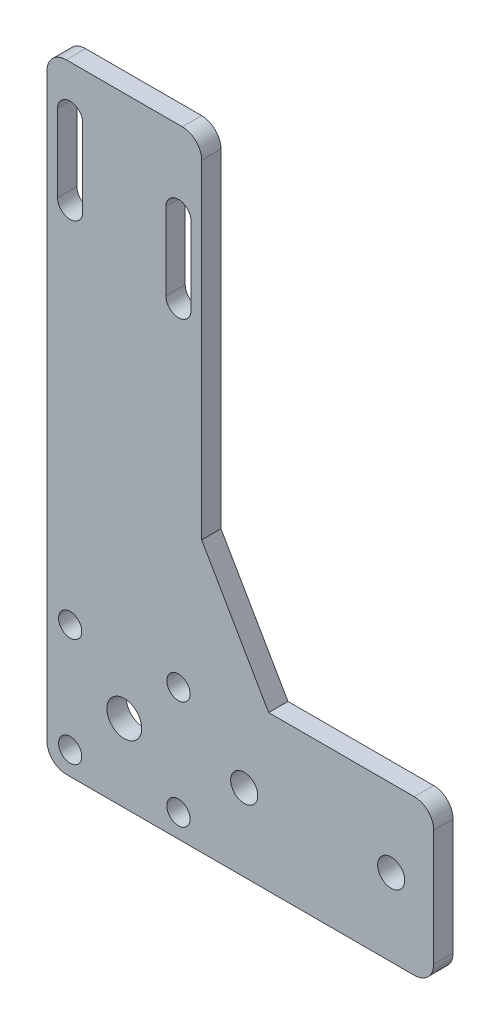
from build123d import *

# Parameters (mm, degrees)
ESQUISSE1_W                  = 40
ESQUISSE1_H                  = 160
BOSS_EXTRU_1_DEPTH           = 5
ENL_V_MAT_EXTRU_1_DEPTH      = 166
ENL_V_MAT_EXTRU_1_DEPTH_BACK = 166
ESQUISSE2_R                  = 4.5
ESQUISSE2_R_2                = 3
ESQUISSE3_W                  = 60
ESQUISSE3_H                  = 40
ESQUISSE3_R                  = 3.5
BOSS_EXTRU_2_DEPTH           = 5
CONG_1_R                     = 5
CHANFREIN1_SIZE              = 30
CHANFREIN1_SIZE2             = 17.320508076


with BuildPart() as part:
    # Esquisse1 → Boss.-Extru.1 (new body)
    with BuildSketch(Plane.XY):
        with Locations((20, 80)):
            Rectangle(ESQUISSE1_W, ESQUISSE1_H)
    extrude(amount=BOSS_EXTRU_1_DEPTH)

    # Esquisse2 → Enlèv. mat.-Extru.1 (cut, two sides: drawn at the far end of the back side and taken through both)
    with BuildSketch(Plane.XY.offset(5).offset(-ENL_V_MAT_EXTRU_1_DEPTH_BACK)):
        with Locations((20, 20)):
            Circle(ESQUISSE2_R)
        with Locations((6, 6)):
            Circle(ESQUISSE2_R_2)
        with Locations(Location((34, 6, 0), (0, 0, 180))):
            Circle(ESQUISSE2_R_2)
        with Locations((34, 34)):
            Circle(ESQUISSE2_R_2)
        with Locations(Location((6, 34, 0), (0, 0, 180))):
            Circle(ESQUISSE2_R_2)
        with BuildLine():
            Line((9.25, 148), (9.25, 128))
            ThreePointArc((9.25, 128), (6, 124.75), (2.75, 128))
            Line((2.75, 128), (2.75, 148))
            ThreePointArc((2.75, 148), (6, 151.25), (9.25, 148))
        make_face()
        with BuildLine():
            Line((30.75, 120), (30.75, 140))
            ThreePointArc((30.75, 140), (34, 143.25), (37.25, 140))
            Line((37.25, 140), (37.25, 120))
            ThreePointArc((37.25, 120), (34, 116.75), (30.75, 120))
        make_face()
    extrude(amount=ENL_V_MAT_EXTRU_1_DEPTH + ENL_V_MAT_EXTRU_1_DEPTH_BACK, mode=Mode.SUBTRACT)

    # Esquisse3 → Boss.-Extru.2 (add)
    with BuildSketch(Plane.XY.offset(5)):
        with Locations((70, 20)):
            Rectangle(ESQUISSE3_W, ESQUISSE3_H)
        with Locations((51, 20)):
            Circle(ESQUISSE3_R, mode=Mode.SUBTRACT)
        with Locations(Location((89, 20, 0), (0, 0, 180))):
            Circle(ESQUISSE3_R, mode=Mode.SUBTRACT)
    extrude(amount=-BOSS_EXTRU_2_DEPTH)

    # Congé1
    cong_1_edges = [part.edges().sort_by_distance(p)[0] for p in [
        (0, 160, 2.5),
        (40, 160, 2.5),
        (0, 0, 2.5),
        (100, 40, 2.5),
        (100, 0, 2.5),
    ]]
    fillet(cong_1_edges, radius=CONG_1_R)

    # Chanfrein1
    chanfrein1_edges = [part.edges().sort_by_distance(p)[0] for p in [
        (40, 40, 2.5),
    ]]
    chanfrein1_side = [part.faces().sort_by_distance(p)[0] for p in [
        (40, 97.5, 2.5),
    ]]
    chamfer(chanfrein1_edges, length=CHANFREIN1_SIZE, length2=CHANFREIN1_SIZE2, reference=chanfrein1_side[0])


solid = part.part
